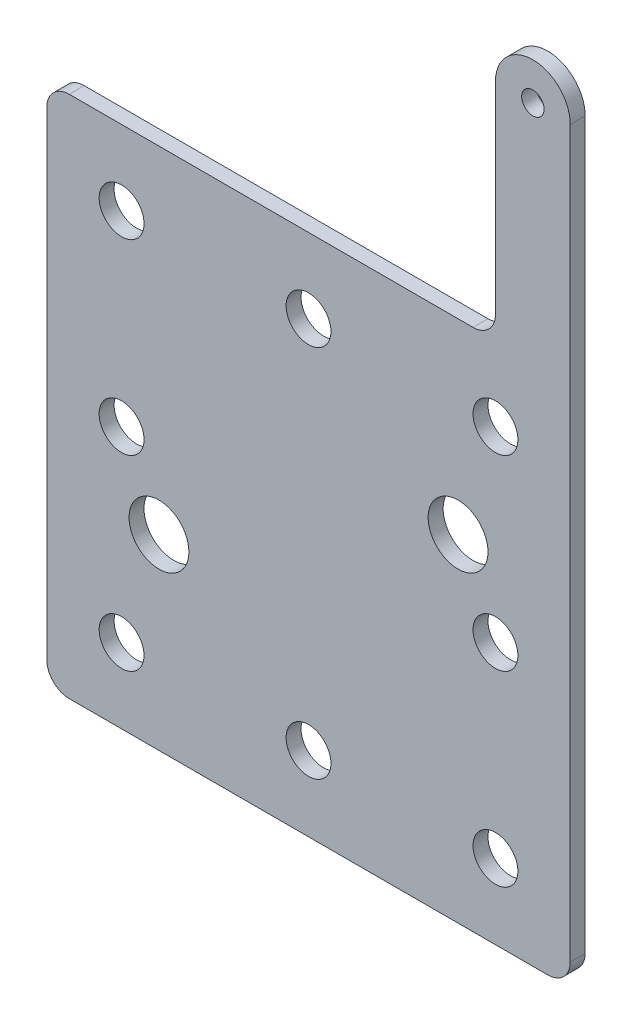
from build123d import *

# Parameters (mm, degrees)
BOSS_EXTRUDE1_DEPTH = 2
SKETCH2_R           = 1.5
CUT_EXTRUDE1_DEPTH  = 2
SKETCH3_R           = 3
SKETCH3_R_2         = 4
CUT_EXTRUDE2_DEPTH  = 10
FILLET1_R           = 3


with BuildPart() as part:
    # Sketch1 → Boss-Extrude1 (new body)
    with BuildSketch(Plane.XY):
        with BuildLine():
            Line((35, 35), (35, 65))
            ThreePointArc((35, 65), (30, 70), (25, 65))
            Line((25, 65), (25, 35))
            Line((25, 35), (-35, 35))
            Line((-35, 35), (-35, -35))
            Line((-35, -35), (35, -35))
            Line((35, -35), (35, 35))
        make_face()
    extrude(amount=BOSS_EXTRUDE1_DEPTH)

    # Sketch2 → Cut-Extrude1 (cut)
    with BuildSketch(Plane.XY.offset(2)):
        with Locations((30, 65)):
            Circle(SKETCH2_R)
    extrude(amount=-CUT_EXTRUDE1_DEPTH, mode=Mode.SUBTRACT)

    # Sketch3 → Cut-Extrude2 (cut)
    with BuildSketch(Plane.XY.offset(2)):
        with Locations((0, 25)):
            Circle(SKETCH3_R)
        with Locations((25, 25)):
            Circle(SKETCH3_R)
        with Locations((25, 0)):
            Circle(SKETCH3_R)
        with Locations((25, -25)):
            Circle(SKETCH3_R)
        with Locations((0, -25)):
            Circle(SKETCH3_R)
        with Locations((-25, -25)):
            Circle(SKETCH3_R)
        with Locations((-25, 0)):
            Circle(SKETCH3_R)
        with Locations((-25, 25)):
            Circle(SKETCH3_R)
        with Locations((-20, -10)):
            Circle(SKETCH3_R_2)
        with Locations((20, 10)):
            Circle(SKETCH3_R_2)
    extrude(amount=-CUT_EXTRUDE2_DEPTH, mode=Mode.SUBTRACT)

    # Fillet1
    fillet1_edges = [part.edges().sort_by_distance(p)[0] for p in [
        (35, -35, 1),
        (-35, -35, 1),
        (-35, 35, 1),
        (25, 35, 1),
    ]]
    fillet(fillet1_edges, radius=FILLET1_R)


solid = part.part
